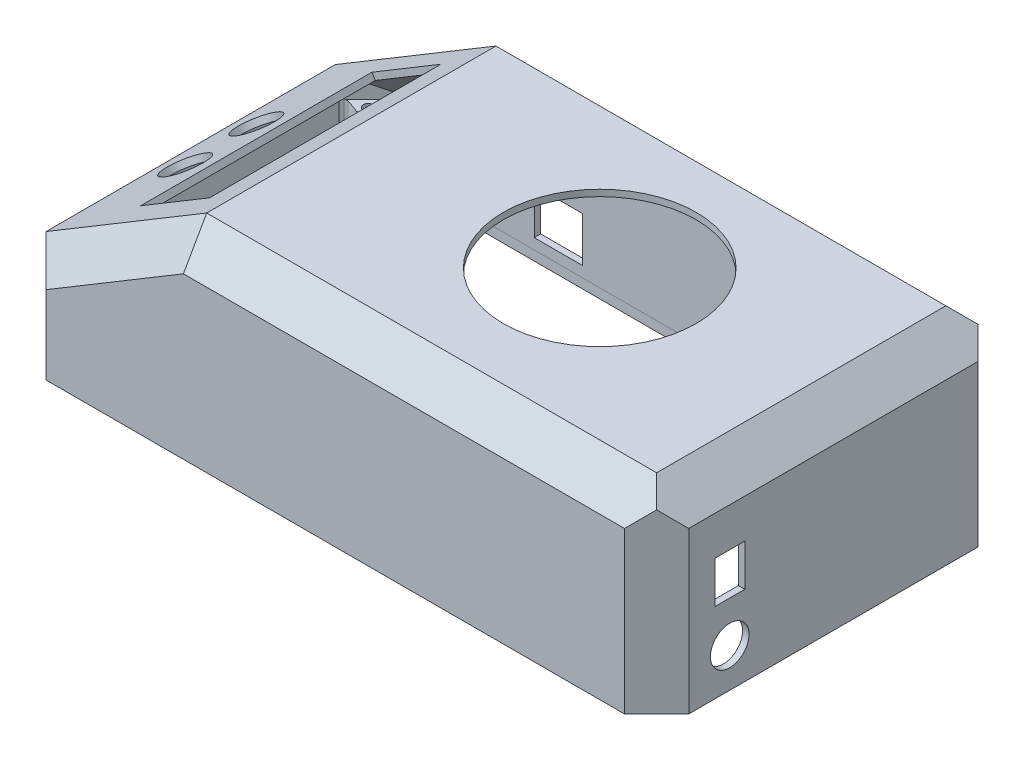
from build123d import *

# Parameters (mm, degrees)
BOSS_EXTRUDE1_DEPTH = 110
CHAMFER1_SIZE       = 10
CHAMFER2_SIZE       = 10
SHELL2_T            = -2
SKETCH2_W           = 25
SKETCH2_H           = 72
CUT_EXTRUDE2_DEPTH  = 90
SKETCH4_R           = 6.5
CUT_EXTRUDE3_DEPTH  = 90
SKETCH5_R           = 1.5
BOSS_EXTRUDE2_DEPTH = 22
FILLET2_R           = 1
CUT_EXTRUDE4_DEPTH  = 3
SKETCH7_R           = 30
CUT_EXTRUDE5_DEPTH  = 61
SKETCH9_R           = 6
SKETCH9_W           = 9.2
SKETCH9_H           = 13
CUT_EXTRUDE6_DEPTH  = 48
SKETCH10_W          = 15
SKETCH10_H          = 14
CUT_EXTRUDE7_DEPTH  = 48


with BuildPart() as part:
    # Sketch1 → Boss-Extrude1 (new body)
    with BuildSketch(Plane.XY):
        Polygon((-200, 30), (-150, 60), (0, 60), (0, 0), (-200, 0), align=None)
    extrude(amount=BOSS_EXTRUDE1_DEPTH)

    # Chamfer1
    chamfer1_edges = [part.edges().sort_by_distance(p)[0] for p in [
        (-175, 45, 110),
        (-200, 15, 110),
        (0, 30, 110),
        (-200, 15, 0),
        (-175, 45, 0),
        (-75, 60, 0),
        (0, 30, 0),
        (-75, 60, 110),
    ]]
    chamfer(chamfer1_edges, length=CHAMFER1_SIZE)

    # Chamfer2
    chamfer2_edges = [part.edges().sort_by_distance(p)[0] for p in [
        (0, 60, 55),
    ]]
    chamfer(chamfer2_edges, length=CHAMFER2_SIZE)

    # Shell2
    shell2_openings = [part.faces().sort_by_distance(p)[0] for p in [
        (-100, 0, 55),
    ]]
    offset(amount=SHELL2_T, openings=shell2_openings, kind=Kind.INTERSECTION)

    # Sketch2 → Cut-Extrude2 (cut)
    with BuildSketch(Plane(origin=(-66.176470588, 110.294117647, 0), x_dir=(0.8574929257125443, 0.5144957554275263, 0), z_dir=(-0.5144957554275263, 0.8574929257125443, 0))):
        with Locations((-120.89691226, -53.994862886)):
            Rectangle(SKETCH2_W, SKETCH2_H)
    extrude(amount=-CUT_EXTRUDE2_DEPTH, mode=Mode.SUBTRACT)

    # Sketch4 → Cut-Extrude3 (cut)
    with BuildSketch(Plane(origin=(-66.176470588, 110.294117647, 0), x_dir=(0.8574929257125443, 0.5144957554275263, 0), z_dir=(-0.5144957554275263, 0.8574929257125443, 0))):
        with Locations(Location((-145.210771321, -43.863127818, 0), (0, 0, 180))):
            Circle(SKETCH4_R)
        with Locations(Location((-145.284101168, -65.939492282, 0), (0, 0, 180))):
            Circle(SKETCH4_R)
    extrude(amount=-CUT_EXTRUDE3_DEPTH, mode=Mode.SUBTRACT)

    # Sketch5 → Boss-Extrude2 (add)
    # profile 1 of 4: a face of its own
    with BuildSketch(Plane.XZ):
        with BuildLine():
            Line((-9.247397896, 106.757043705), (-3.256064459, 100.483765165))
            ThreePointArc((-3.256064459, 100.483765165), (-5.744873038, 99.736713828), (-7.870281401, 98.241757931))
            ThreePointArc((-7.870281401, 98.241757931), (-10.292221795, 99.429108259), (-11.636574356, 101.767550533))
            ThreePointArc((-11.636574356, 101.767550533), (-10.323587398, 104.205602893), (-9.247397896, 106.757043705))
        make_face()
        with Locations((-8.511299496, 101.440505433)):
            Circle(SKETCH5_R, mode=Mode.SUBTRACT)
    # profile 2 of 4: a face of its own
    with BuildSketch(Plane.XZ):
        with BuildLine():
            Line((-10.039510209, 2.683192712), (-3.513368166, 9.046181203))
            ThreePointArc((-3.513368166, 9.046181203), (-5.632030744, 9.88127065), (-7.41571196, 11.29710497))
            ThreePointArc((-7.41571196, 11.29710497), (-9.918845287, 10.389628717), (-11.372165694, 8.158698553))
            ThreePointArc((-11.372165694, 8.158698553), (-10.188591886, 5.546835518), (-10.039510209, 2.683192712))
        make_face()
        with Locations((-8.560298278, 8.510476998)):
            Circle(SKETCH5_R, mode=Mode.SUBTRACT)
    # profile 3 of 4: a face of its own
    with BuildSketch(Plane.XZ):
        with BuildLine():
            Line((-190.1639185, 107.037062189), (-196.90252996, 100.401487601))
            ThreePointArc((-196.90252996, 100.401487601), (-194.442462904, 99.997388644), (-192.214833899, 98.878060765))
            ThreePointArc((-192.214833899, 98.878060765), (-190.200311855, 99.737450982), (-188.807968894, 101.428081542))
            ThreePointArc((-188.807968894, 101.428081542), (-190.20827937, 104.057949981), (-190.1639185, 107.037062189))
        make_face()
        with Locations((-191.50742986, 101.422355381)):
            Circle(SKETCH5_R, mode=Mode.SUBTRACT)
    # profile 4 of 4: a face of its own
    with BuildSketch(Plane.XZ):
        with BuildLine():
            Line((-190.456179178, 3.22389745), (-196.869032371, 9.61475183))
            ThreePointArc((-196.869032371, 9.61475183), (-194.424366222, 10.415493615), (-192.013666474, 11.313328071))
            ThreePointArc((-192.013666474, 11.313328071), (-189.789786951, 9.928723292), (-188.777999187, 7.512309411))
            ThreePointArc((-188.777999187, 7.512309411), (-190.165240448, 5.582610921), (-190.456179178, 3.22389745))
        make_face()
        with Locations((-191.356454927, 8.42171973)):
            Circle(SKETCH5_R, mode=Mode.SUBTRACT)
    extrude(amount=-BOSS_EXTRUDE2_DEPTH)

    # Fillet2
    fillet2_edges = [part.edges().sort_by_distance(p)[0] for p in [
        (-196.80570876, 11, 9.634135884),
        (-190.464527553, 11, 3.292954677),
        (-188.777999187, 11, 7.512309411),
        (-192.013666474, 11, 11.313328071),
        (-10.024061604, 11, 2.80436552),
        (-3.72900082, 11, 9.099426304),
        (-7.41571196, 11, 11.29710497),
        (-11.372165694, 11, 8.158698553),
        (-196.772588823, 11, 100.398984052),
        (-190.174781799, 11, 106.996791076),
        (-192.214833899, 11, 98.878060765),
        (-188.807968894, 11, 101.428081542),
        (-3.305525067, 11, 100.477097942),
        (-9.339081083, 11, 106.510653959),
        (-11.636574356, 11, 101.767550533),
        (-7.870281401, 11, 98.241757931),
    ]]
    fillet(fillet2_edges, radius=FILLET2_R)

    # Sketch6 → Cut-Extrude4 (cut)
    with BuildSketch(Plane.XZ):
        Polygon((-198.003014977, 10.842085531), (-189.211900871, 1.9947291), (-10.828081787, 1.9947291), (-2.004701189, 10.828504844), (-2.004701189, 99.205715336), (-10.87289136, 108.000350983), (-189.173255871, 108.000350983), (-198.003014977, 99.184415132), align=None)
    extrude(amount=-CUT_EXTRUDE4_DEPTH, mode=Mode.SUBTRACT)

    # Sketch7 → Cut-Extrude5 (cut)
    with BuildSketch(Plane(origin=(0, 60, 0), x_dir=(1, 0, 0), z_dir=(0, 1, 0))):
        with Locations(Location((-74.048474832, -53.651868822, 0), (0, 0, 180))):
            Circle(SKETCH7_R)
    extrude(amount=-CUT_EXTRUDE5_DEPTH, mode=Mode.SUBTRACT)

    # Sketch9 → Cut-Extrude6 (cut)
    with BuildSketch(Plane(origin=(0, 0, 0), x_dir=(0, 0, -1), z_dir=(1, 0, 0))):
        with Locations((-87.253164056, 12.081575525)):
            Circle(SKETCH9_R)
        with Locations((-87.170080289, 31.378854617)):
            Rectangle(SKETCH9_W, SKETCH9_H)
    extrude(amount=-CUT_EXTRUDE6_DEPTH, mode=Mode.SUBTRACT)

    # Sketch10 → Cut-Extrude7 (cut)
    with BuildSketch(Plane(origin=(0, 0, 0), x_dir=(-1, 0, 0), z_dir=(0, 0, -1))):
        with Locations((138.565692725, 13.322096046)):
            Rectangle(SKETCH10_W, SKETCH10_H)
    extrude(amount=-CUT_EXTRUDE7_DEPTH, mode=Mode.SUBTRACT)


solid = part.part
